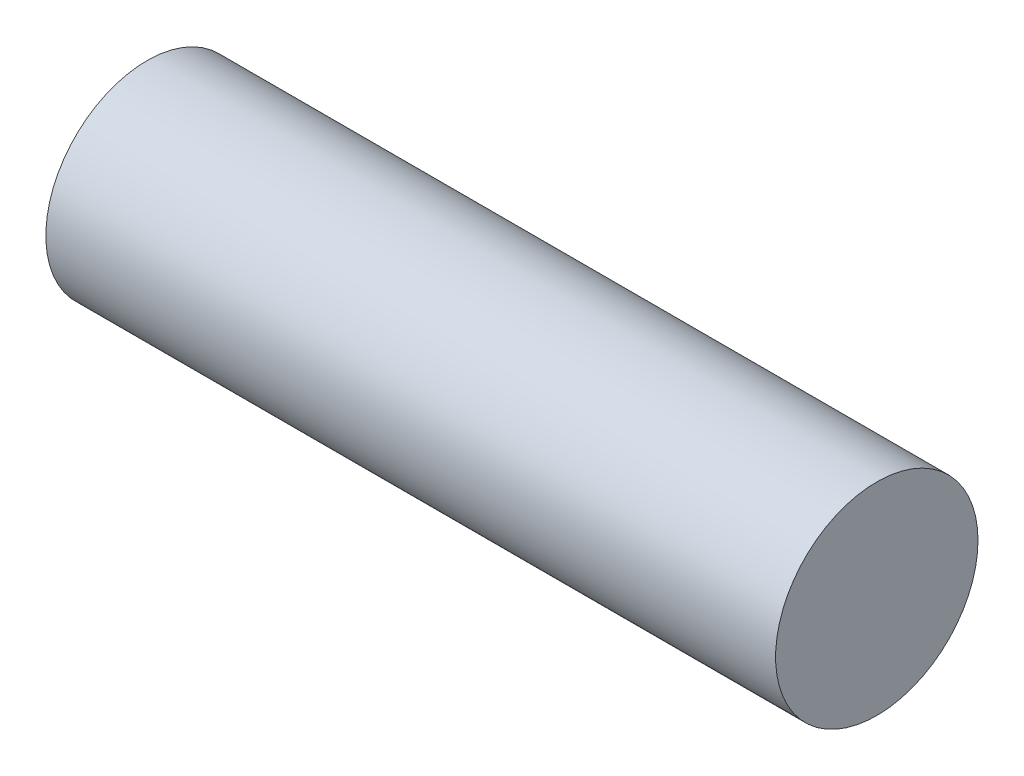
from build123d import *

# Parameters (mm, degrees)
CELL_SK1_R = 9.5
CELL_DEPTH = 68.5


with BuildPart() as part:
    # Cell_Sk1 → Cell (new body)
    with BuildSketch(Plane(origin=(-43.05, 0, 0), x_dir=(0, 0, -1), z_dir=(1, 0, 0))):
        with Locations((20.45, -18.05)):
            Circle(CELL_SK1_R)
    extrude(amount=CELL_DEPTH)


solid = part.part
